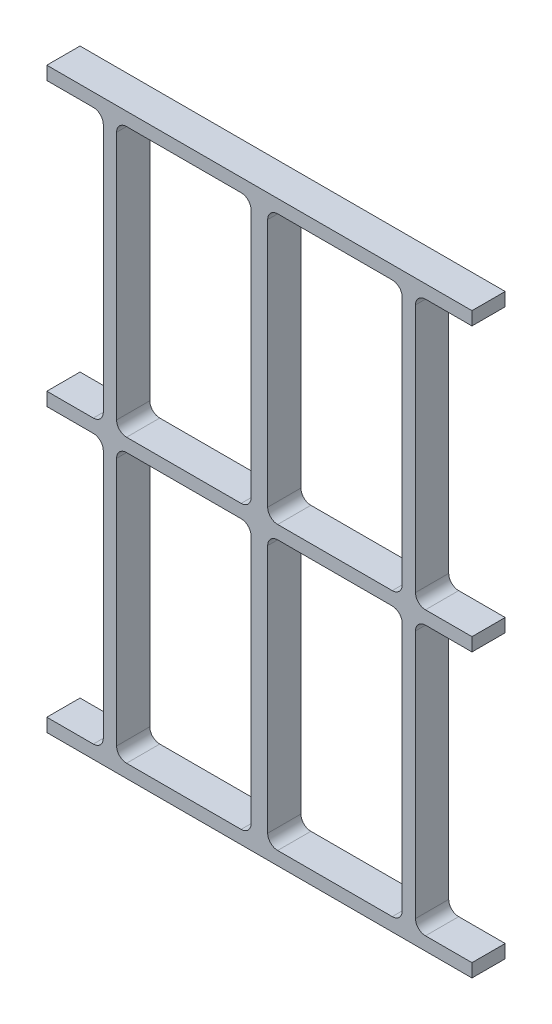
from build123d import *

# Parameters (mm, degrees)
SKETCH1_W           = 40.5
SKETCH1_H           = 81
BOSS_EXTRUDE1_DEPTH = 10
FILLET1_R           = 3


with BuildPart() as part:
    # Sketch1 → Boss-Extrude1 (new body)
    with BuildSketch(Plane.XY):
        Polygon((-64, 129.5), (-64, 125.5), (-47, 125.5), (-47, 44.5), (-64, 44.5), (-64, 40.5), (-47, 40.5), (-47, -40.5), (-64, -40.5), (-64, -44.5), (0, -44.5), (64, -44.5), (64, -40.5), (47, -40.5), (47, 40.5), (64, 40.5), (64, 44.5), (47, 44.5), (47, 125.5), (64, 125.5), (64, 129.5), (0, 129.5), align=None)
        with Locations((-22.75, 0)):
            Rectangle(SKETCH1_W, SKETCH1_H, mode=Mode.SUBTRACT)
        with Locations((22.75, 0)):
            Rectangle(SKETCH1_W, SKETCH1_H, mode=Mode.SUBTRACT)
        with Locations((-22.75, 85)):
            Rectangle(SKETCH1_W, SKETCH1_H, mode=Mode.SUBTRACT)
        with Locations((22.75, 85)):
            Rectangle(SKETCH1_W, SKETCH1_H, mode=Mode.SUBTRACT)
    extrude(amount=BOSS_EXTRUDE1_DEPTH)

    # Fillet1
    fillet1_edges = [part.edges().sort_by_distance(p)[0] for p in [
        (43, -40.5, 5),
        (43, 40.5, 5),
        (2.5, 40.5, 5),
        (2.5, -40.5, 5),
        (43, 44.5, 5),
        (43, 125.5, 5),
        (2.5, 125.5, 5),
        (2.5, 44.5, 5),
        (-43, 40.5, 5),
        (-43, -40.5, 5),
        (-2.5, -40.5, 5),
        (-2.5, 40.5, 5),
        (-43, 125.5, 5),
        (-43, 44.5, 5),
        (-2.5, 44.5, 5),
        (-2.5, 125.5, 5),
        (-47, 44.5, 5),
        (-47, 125.5, 5),
        (47, 125.5, 5),
        (47, 44.5, 5),
        (47, 40.5, 5),
        (47, -40.5, 5),
        (-47, -40.5, 5),
        (-47, 40.5, 5),
    ]]
    fillet(fillet1_edges, radius=FILLET1_R)


solid = part.part
